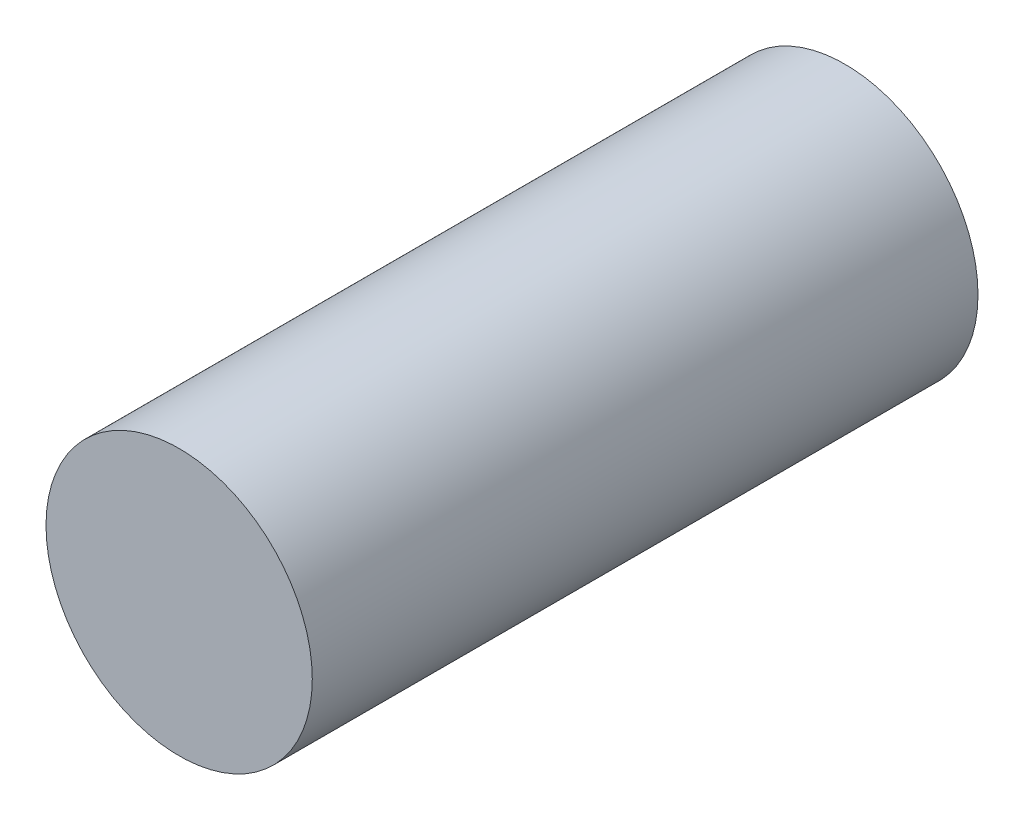
from build123d import *

# Parameters (mm, degrees)
SCHIZZO1_R                   = 4
ESTRUSIONE_ESTRUSIONE1_DEPTH = 20


with BuildPart() as part:
    # Schizzo1 → Estrusione-Estrusione1 (new body)
    with BuildSketch(Plane.XY):
        Circle(SCHIZZO1_R)
    extrude(amount=ESTRUSIONE_ESTRUSIONE1_DEPTH)


solid = part.part
